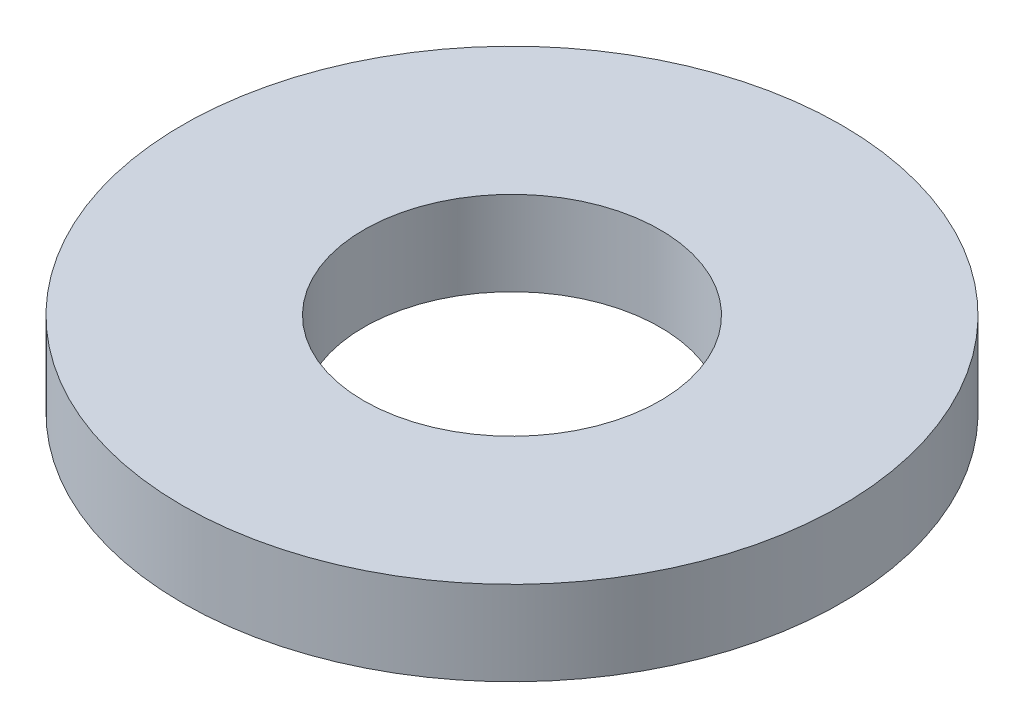
from build123d import *

# Parameters (mm, degrees)
SKETCH1_W = 4.3688
SKETCH1_H = 2.032


with BuildPart() as part:
    # Sketch1 → Revolve1 (revolve)
    with BuildSketch(Plane(origin=(0, 0, 0), x_dir=(0, 0, -1), z_dir=(1, 0, 0)), mode=Mode.PRIVATE) as revolve1_sk:
        with Locations((5.7531, 0)):
            Rectangle(SKETCH1_W, SKETCH1_H)
    revolve(revolve1_sk.sketch.rotate(Axis((0, 19.435564798, 0), (0, -1, 0)), 180), axis=Axis((0, 19.435564798, 0), (0, -1, 0)))


solid = part.part
